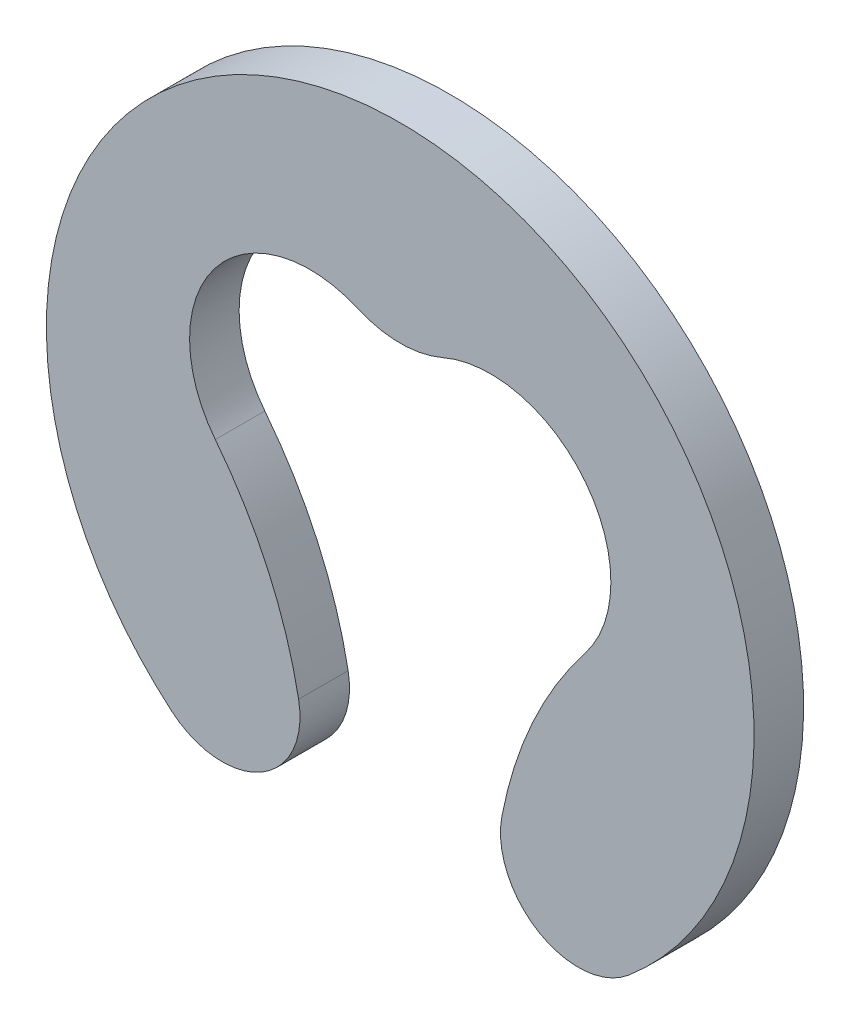
from build123d import *

# Parameters (mm, degrees)
CROQUIS1_R              = 5
SALIENTE_EXTRUIR1_DEPTH = 0.7
CORTAR_EXTRUIR1_REACH   = 9.106
REDONDEO1_R             = 1.1


with BuildPart() as part:
    # Croquis1 → Saliente-Extruir1 (new body)
    with BuildSketch(Plane.XY):
        Circle(CROQUIS1_R)
    extrude(amount=SALIENTE_EXTRUIR1_DEPTH)

    # Croquis2 → Cortar-Extruir1 (cut, up to next)
    with BuildSketch(Plane.XY.offset(0.7), mode=Mode.PRIVATE) as cortar_extruir1_sk1:
        with BuildLine():
            ThreePointArc((-0.598421585, 2.424539493), (0, 2.3), (0.598421585, 2.424539493))
            ThreePointArc((0.598421585, 2.424539493), (2.622160983, 1.904699976), (2.61328938, -0.184719936))
            ThreePointArc((2.61328938, -0.184719936), (1.528064828, -2.366548348), (1.4, -4.8))
            ThreePointArc((1.4, -4.8), (0, -5), (-1.4, -4.8))
            ThreePointArc((-1.4, -4.8), (-1.528064828, -2.366548348), (-2.61328938, -0.184719936))
            ThreePointArc((-2.61328938, -0.184719936), (-2.622160983, 1.904699976), (-0.598421585, 2.424539493))
        make_face()
    cortar_extruir1_tool1 = extrude(cortar_extruir1_sk1.sketch, amount=-CORTAR_EXTRUIR1_REACH, mode=Mode.PRIVATE) & part.part
    add(cortar_extruir1_tool1.solids().sort_by_distance((0, -0.660031, 0.7))[0], mode=Mode.SUBTRACT)

    # Redondeo1
    redondeo1_edges = [part.edges().sort_by_distance(p)[0] for p in [
        (1.4, -4.8, 0.35),
        (-1.4, -4.8, 0.35),
    ]]
    fillet(redondeo1_edges, radius=REDONDEO1_R)


solid = part.part
